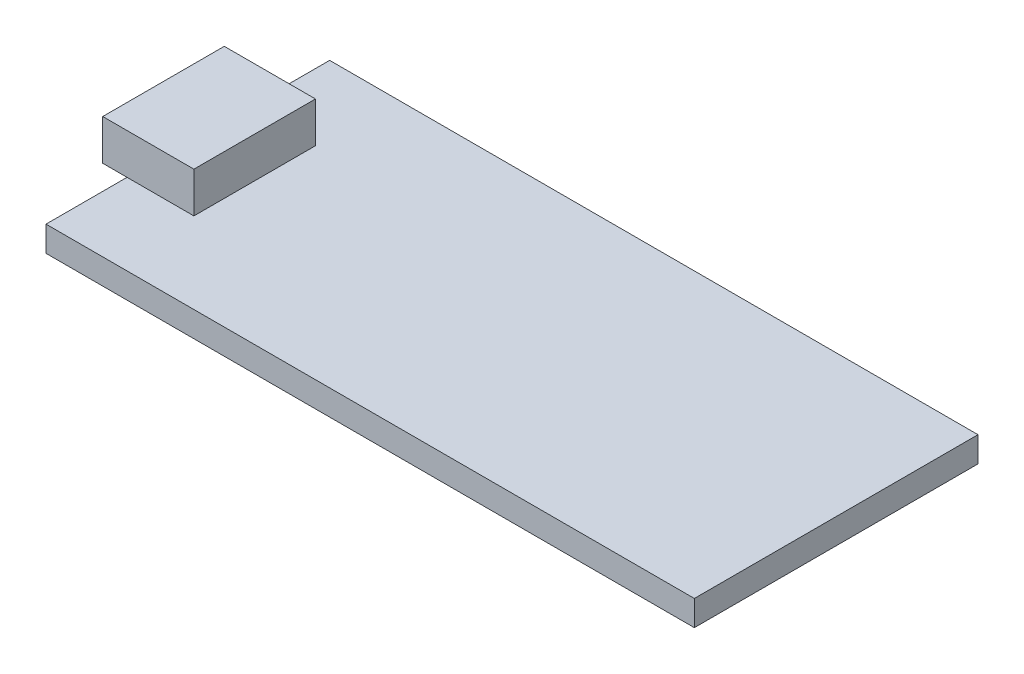
from build123d import *

# Parameters (mm, degrees)
SKETCH1_W           = 40.64
SKETCH1_H           = 17.78
BOSS_EXTRUDE1_DEPTH = 1.5875
SKETCH2_W           = 5.715
SKETCH2_H           = 7.62
BOSS_EXTRUDE2_DEPTH = 2.54


with BuildPart() as part:
    # Sketch1 → Boss-Extrude1 (new body)
    with BuildSketch(Plane(origin=(0, 0, 0), x_dir=(1, 0, 0), z_dir=(0, 1, 0))):
        with Locations((20.32, 8.89)):
            Rectangle(SKETCH1_W, SKETCH1_H)
    extrude(amount=BOSS_EXTRUDE1_DEPTH)

    # Sketch2 → Boss-Extrude2 (add)
    with BuildSketch(Plane(origin=(0, 1.5875, 0), x_dir=(1, 0, 0), z_dir=(0, 1, 0))):
        with Locations((1.3335, 8.89)):
            Rectangle(SKETCH2_W, SKETCH2_H)
    extrude(amount=BOSS_EXTRUDE2_DEPTH)


solid = part.part
